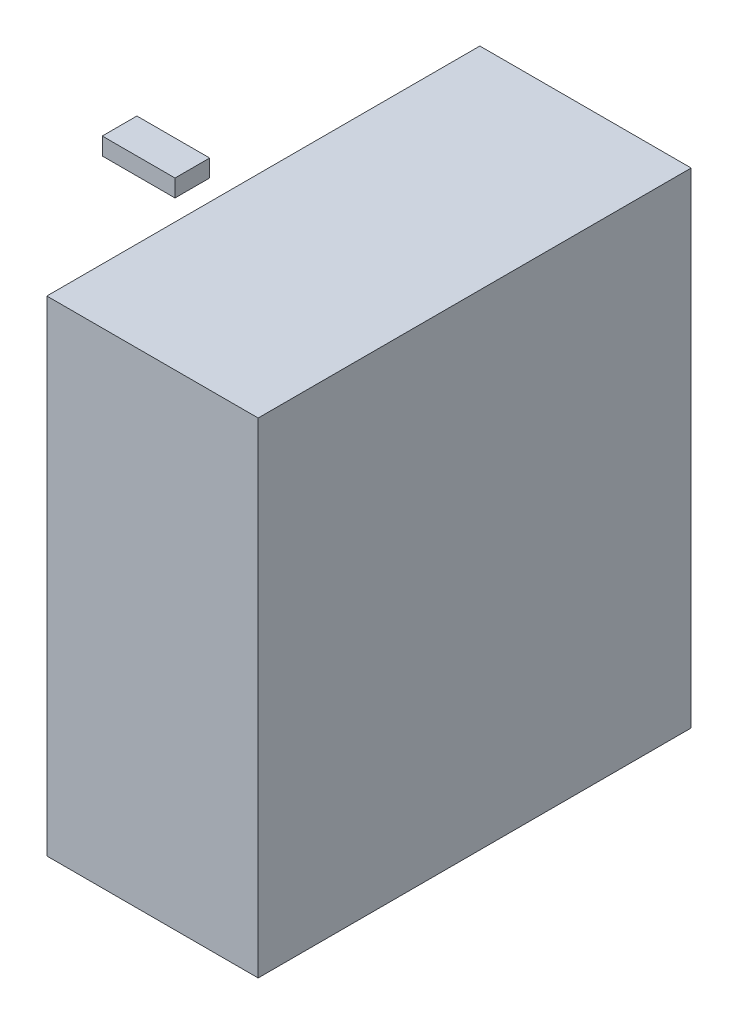
from build123d import *

# Parameters (mm, degrees)
BOSS_EXTRUDE1_DEPTH = 14
BOSS_EXTRUDE2_START = -0.6
SKETCH1_3_W         = 2.1
SKETCH1_3_H         = 1
BOSS_EXTRUDE2_DEPTH = 0.5
BOSS_EXTRUDE3_START = 14.6
SKETCH1_4_W         = 2.1
SKETCH1_4_H         = 1
BOSS_EXTRUDE3_DEPTH = 0.5


with BuildPart() as part:
    # Sketch1 → Boss-Extrude1 (new body)
    with BuildSketch(Plane(origin=(0, 0, 0), x_dir=(1, 0, 0), z_dir=(0, 1, 0))):
        Polygon((0, 0), (0, -7.8), (0, -8.8), (0, -12.5), (6.1, -12.5), (6.1, 0), align=None)
    extrude(amount=BOSS_EXTRUDE1_DEPTH)


with BuildPart() as body_2:
    # Sketch1<3> → Boss-Extrude2 (new body)
    with BuildSketch(Plane(origin=(0, 0, 0), x_dir=(1, 0, 0), z_dir=(0, 1, 0)).offset(BOSS_EXTRUDE2_START)):
        with Locations((-1.05, -8.3)):
            Rectangle(SKETCH1_3_W, SKETCH1_3_H)
    extrude(amount=-BOSS_EXTRUDE2_DEPTH)


with BuildPart() as body_3:
    # Sketch1<4> → Boss-Extrude3 (new body)
    with BuildSketch(Plane(origin=(0, 0, 0), x_dir=(1, 0, 0), z_dir=(0, 1, 0)).offset(BOSS_EXTRUDE3_START)):
        with Locations((-1.05, -8.3)):
            Rectangle(SKETCH1_4_W, SKETCH1_4_H)
    extrude(amount=BOSS_EXTRUDE3_DEPTH)


solid = Compound([part.part, body_2.part, body_3.part])
